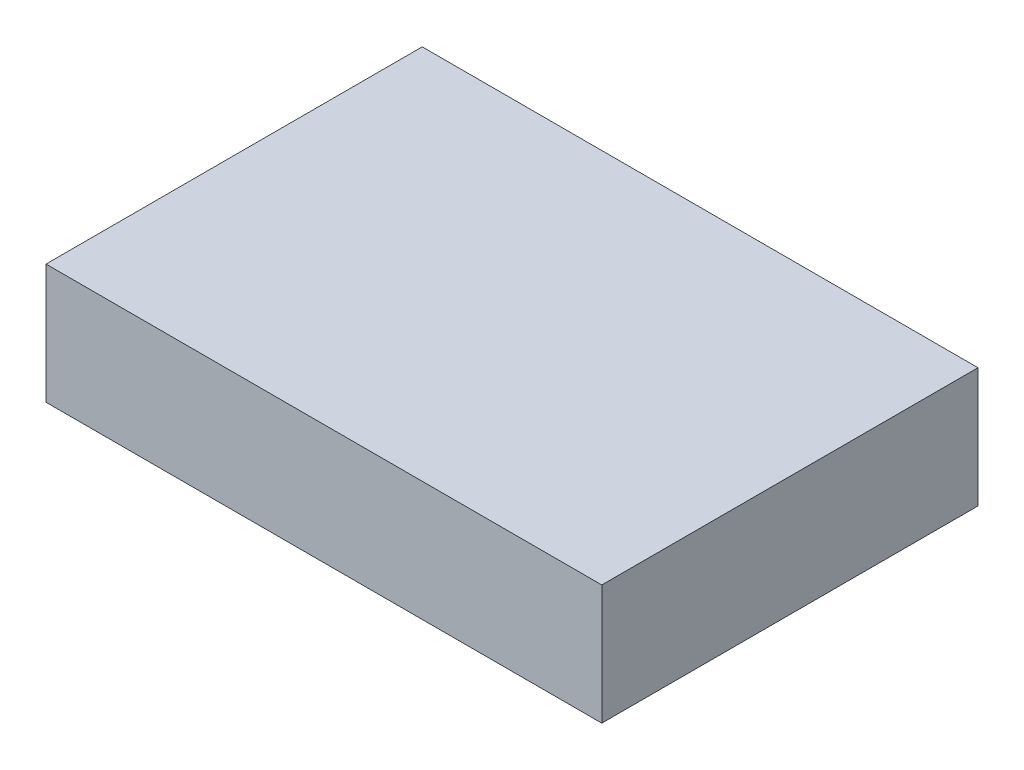
from build123d import *

# Parameters (mm, degrees)
SKETCH1_W      = 16.51
SKETCH1_H      = 11.176
EXTRUDE1_DEPTH = 3.556


with BuildPart() as part:
    # Sketch1 → Extrude1 (new body)
    with BuildSketch(Plane(origin=(0, 0, 0), x_dir=(1, 0, 0), z_dir=(0, 1, 0))):
        with Locations((8.255, 5.588)):
            Rectangle(SKETCH1_W, SKETCH1_H)
    extrude(amount=EXTRUDE1_DEPTH)


solid = part.part
